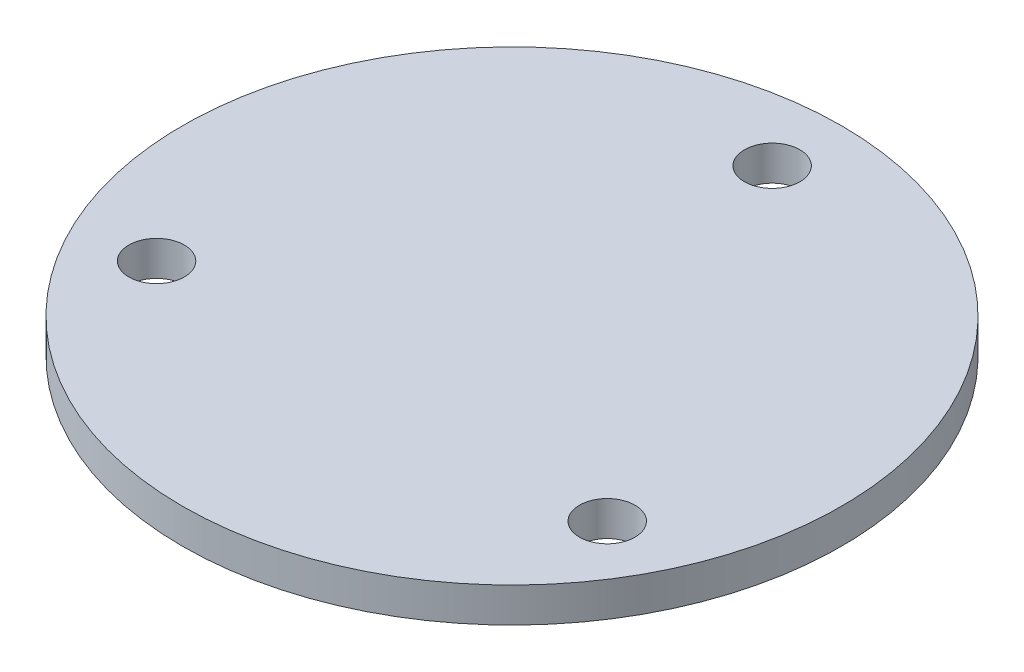
from build123d import *

# Parameters (mm, degrees)
SKETCH1_R           = 19
SKETCH1_R_2         = 1.6
BOSS_EXTRUDE1_DEPTH = 2


with BuildPart() as part:
    # Sketch1 → Boss-Extrude1 (new body)
    with BuildSketch(Plane(origin=(0, 0, 0), x_dir=(1, 0, 0), z_dir=(0, 1, 0))):
        with Locations(Location((0, 0, 0), (0, 0, 270))):
            Circle(SKETCH1_R)
        with Locations(Location((0, 15, 0), (0, 0, 270))):
            Circle(SKETCH1_R_2, mode=Mode.SUBTRACT)
        with Locations(Location((12.990381057, -7.5, 0), (0, 0, 270))):
            Circle(SKETCH1_R_2, mode=Mode.SUBTRACT)
        with Locations(Location((-12.990381057, -7.5, 0), (0, 0, 270))):
            Circle(SKETCH1_R_2, mode=Mode.SUBTRACT)
    extrude(amount=BOSS_EXTRUDE1_DEPTH)


solid = part.part
